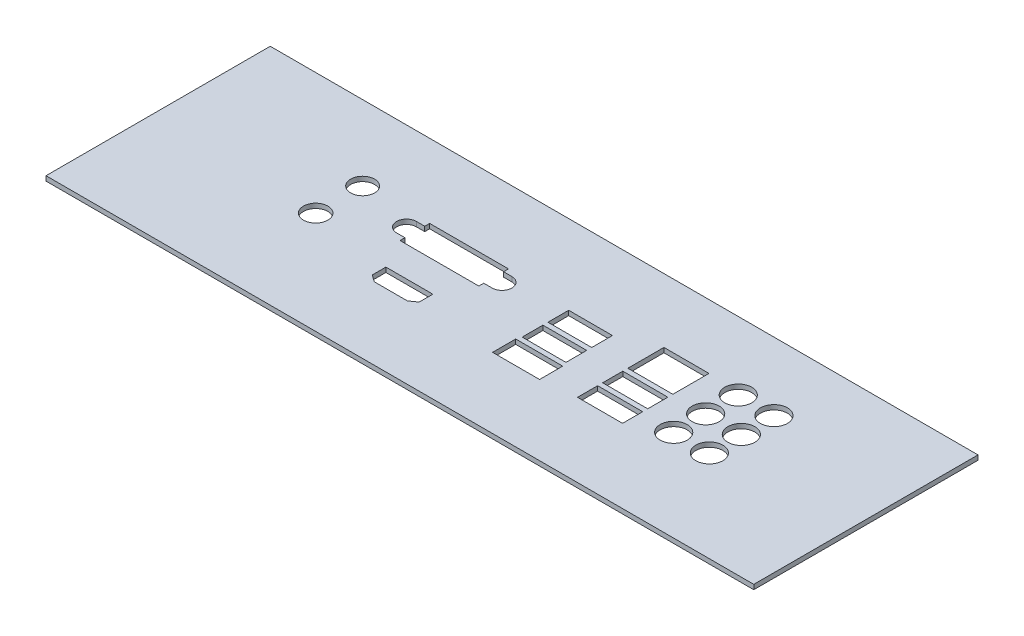
from build123d import *

# Parameters (mm, degrees)
SKETCH1_W           = 239.388843642
SKETCH1_H           = 75.842411424
BOSS_EXTRUDE1_DEPTH = 1.5875
SKETCH2_R           = 4.1275
SKETCH2_R_2         = 4.572
SKETCH2_R_3         = 4.0513
SKETCH2_W           = 14.8082
SKETCH2_H           = 7.0104
SKETCH2_W_2         = 15.9004
SKETCH2_H_2         = 7.8232
SKETCH2_W_3         = 15.24
SKETCH2_H_3         = 12.2174
SKETCH2_H_4         = 6.8072
CUT_EXTRUDE1_DEPTH  = 126.567880503


with BuildPart() as part:
    # Sketch1 → Boss-Extrude1 (new body)
    with BuildSketch(Plane(origin=(0, 0, 0), x_dir=(1, 0, 0), z_dir=(0, 1, 0))):
        Rectangle(SKETCH1_W, SKETCH1_H)
    extrude(amount=-BOSS_EXTRUDE1_DEPTH)

    # Sketch2 → Cut-Extrude1 (cut, through all)
    with BuildSketch(Plane(origin=(0, 0, 0), x_dir=(1, 0, 0), z_dir=(0, 1, 0))):
        with Locations(Location((-63.132337736, -3.268680215, 0), (0, 0, 270))):
            Circle(SKETCH2_R)
        with Locations(Location((61.619762264, -6.935920215, 0), (0, 0, 270))):
            Circle(SKETCH2_R_2)
        with Locations(Location((-63.132337736, 12.606319785, 0), (0, 0, 270))):
            Circle(SKETCH2_R_3)
        with Locations(Location((61.619762264, 14.908079785, 0), (0, 0, 270))):
            Circle(SKETCH2_R_2)
        with Locations(Location((73.684762264, 14.908079785, 0), (0, 0, 270))):
            Circle(SKETCH2_R_2)
        with Locations(Location((61.619762264, 3.884479785, 0), (0, 0, 270))):
            Circle(SKETCH2_R_2)
        with Locations(Location((73.684762264, 3.884479785, 0), (0, 0, 270))):
            Circle(SKETCH2_R_2)
        with Locations(Location((73.684762264, -6.935920215, 0), (0, 0, 270))):
            Circle(SKETCH2_R_2)
        Polygon((-35.446337736, -7.200470753), (-19.571337736, -7.200470753), (-19.571337736, -11.829133142), (-21.920837736, -13.474270753), (-33.096837736, -13.474270753), (-35.446337736, -11.829133142), align=None)
        with BuildLine():
            Line((-40.843837736, 4.623229247), (-40.843837736, 2.959529247))
            Line((-40.843837736, 2.959529247), (-14.173837736, 2.959529247))
            Line((-14.173837736, 2.959529247), (-14.173837736, 4.623229247))
            Line((-14.173837736, 4.623229247), (-11.367137736, 4.623229247))
            ThreePointArc((-11.367137736, 4.623229247), (-8.014337736, 7.976029247), (-11.367137736, 11.328829247))
            Line((-11.367137736, 11.328829247), (-14.173837736, 11.328829247))
            Line((-14.173837736, 11.328829247), (-14.173837736, 12.992529247))
            Line((-14.173837736, 12.992529247), (-40.843837736, 12.992529247))
            Line((-40.843837736, 12.992529247), (-40.843837736, 11.328829247))
            Line((-40.843837736, 11.328829247), (-43.650537736, 11.328829247))
            ThreePointArc((-43.650537736, 11.328829247), (-47.003337736, 7.976029247), (-43.650537736, 4.623229247))
            Line((-43.650537736, 4.623229247), (-40.843837736, 4.623229247))
        make_face()
        with Locations((15.513959311, 7.554779785)):
            Rectangle(SKETCH2_W, SKETCH2_H)
        with Locations((15.513959311, -1.157420215)):
            Rectangle(SKETCH2_W, SKETCH2_H)
        with Locations((15.513959311, -10.225220215)):
            Rectangle(SKETCH2_W_2, SKETCH2_H_2)
        with Locations((42.722162264, 10.180619785)):
            Rectangle(SKETCH2_W_3, SKETCH2_H_3)
        with Locations((42.722162264, -1.033480215)):
            Rectangle(SKETCH2_W_3, SKETCH2_H_4)
        with Locations((42.722162264, -9.542480215)):
            Rectangle(SKETCH2_W_3, SKETCH2_H_4)
    extrude(amount=-CUT_EXTRUDE1_DEPTH, mode=Mode.SUBTRACT)


solid = part.part
